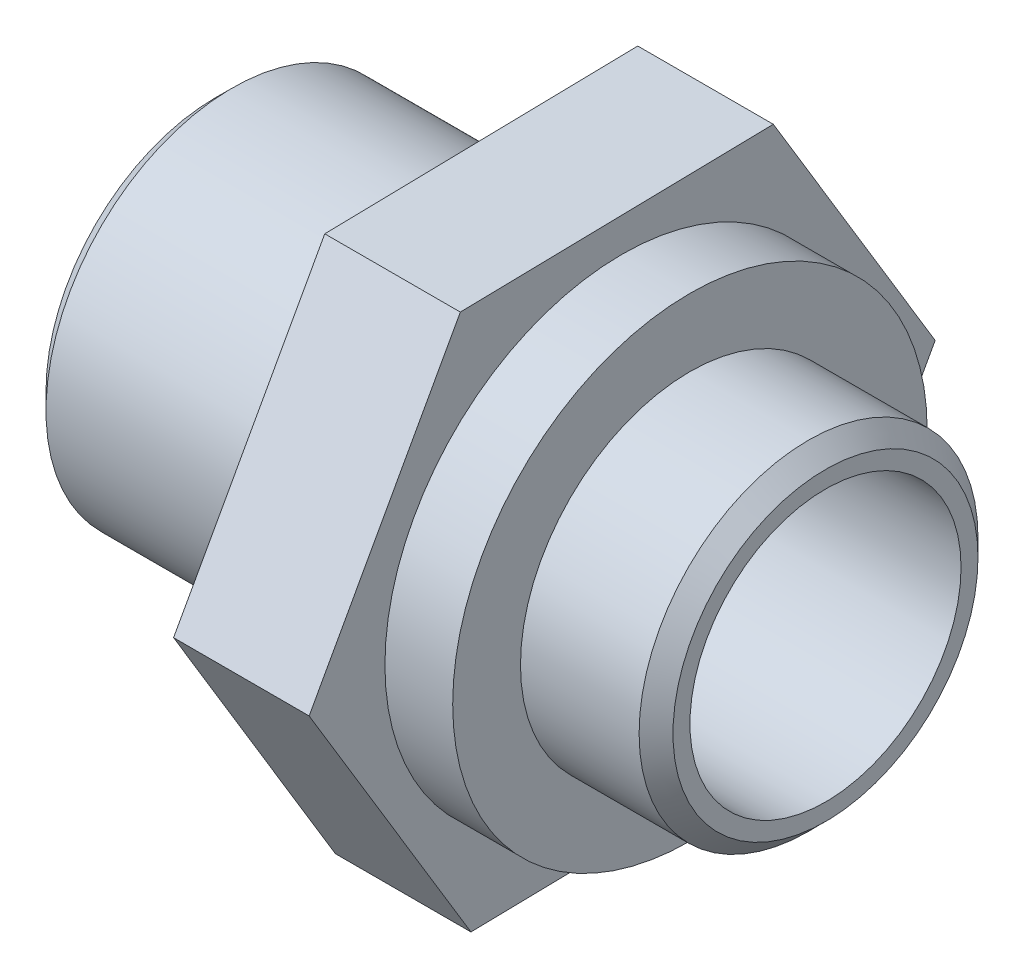
from build123d import *

# Parameters (mm, degrees)
SKETCH1_R           = 2.75
BOSS_EXTRUDE1_DEPTH = 4
BOSS_EXTRUDE2_DEPTH = 2
SKETCH3_R           = 3.5
BOSS_EXTRUDE3_DEPTH = 1
SKETCH4_R           = 2.5
BOSS_EXTRUDE4_DEPTH = 2
SKETCH5_R           = 2
CUT_EXTRUDE1_DEPTH  = 11.89415542
CHAMFER1_SIZE       = 0.25


with BuildPart() as part:
    # Sketch1 → Boss-Extrude1 (new body)
    with BuildSketch(Plane(origin=(0, 0, 0), x_dir=(0, 0, -1), z_dir=(1, 0, 0))):
        Circle(SKETCH1_R)
    extrude(amount=BOSS_EXTRUDE1_DEPTH)

    # Sketch2 → Boss-Extrude2 (add)
    with BuildSketch(Plane(origin=(4, 0, 0), x_dir=(0, 0, -1), z_dir=(1, 0, 0))):
        Polygon((2.230666132, 4.044435924), (-2.387251188, 3.954031499), (-4.61791732, -0.090404424), (-2.230666132, -4.044435924), (2.387251188, -3.954031499), (4.61791732, 0.090404424), align=None)
    extrude(amount=BOSS_EXTRUDE2_DEPTH)

    # Sketch3 → Boss-Extrude3 (add)
    with BuildSketch(Plane(origin=(6, 0, 0), x_dir=(0, 0, -1), z_dir=(1, 0, 0))):
        Circle(SKETCH3_R)
    extrude(amount=BOSS_EXTRUDE3_DEPTH)

    # Sketch4 → Boss-Extrude4 (add)
    with BuildSketch(Plane(origin=(7, 0, 0), x_dir=(0, 0, -1), z_dir=(1, 0, 0))):
        Circle(SKETCH4_R)
    extrude(amount=BOSS_EXTRUDE4_DEPTH)

    # Sketch5 → Cut-Extrude1 (cut, through all)
    with BuildSketch(Plane(origin=(9, 0, 0), x_dir=(0, 0, -1), z_dir=(1, 0, 0))):
        Circle(SKETCH5_R)
    extrude(amount=-CUT_EXTRUDE1_DEPTH, mode=Mode.SUBTRACT)

    # Chamfer1
    chamfer1_edges = [part.edges().sort_by_distance(p)[0] for p in [
        (0, 0, 2.75),
        (9, 0, 2.5),
    ]]
    chamfer(chamfer1_edges, length=CHAMFER1_SIZE)


solid = part.part
